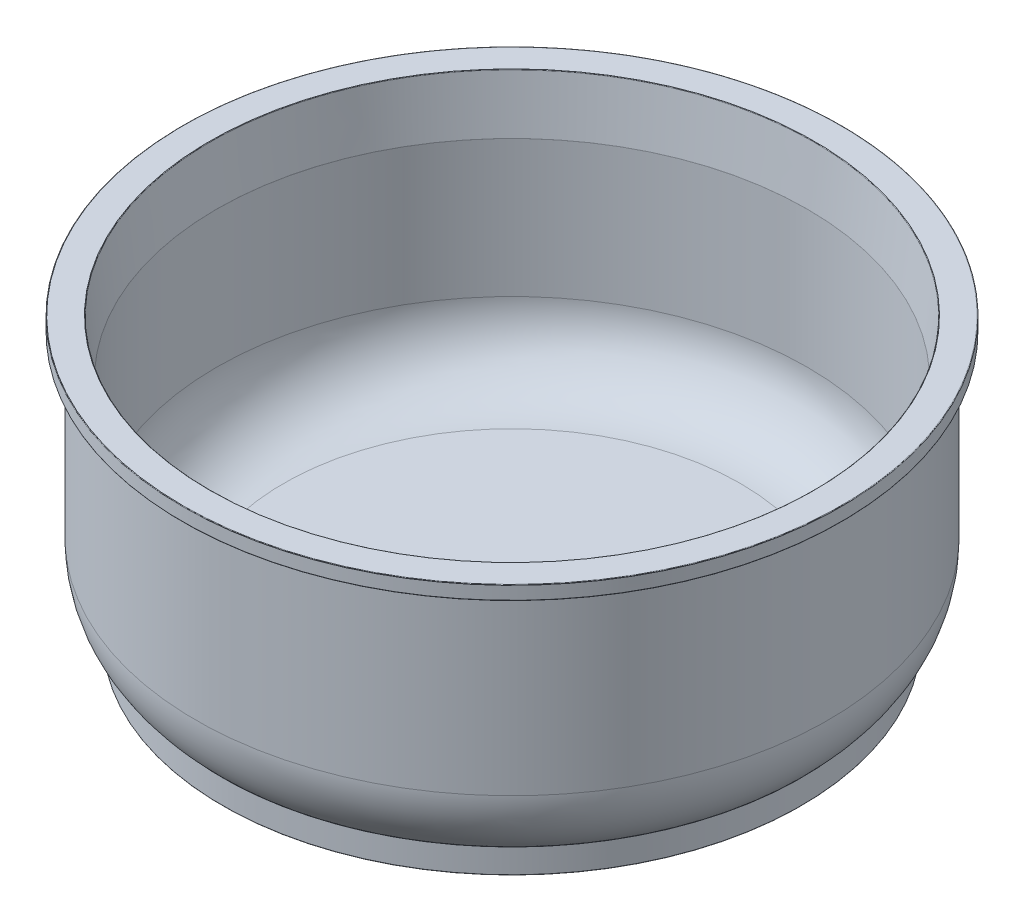
from build123d import *

# Parameters (mm, degrees)
FILLET1_R = 0.3


with BuildPart() as part:
    # Sketch1 → Revolve1 (revolve)
    with BuildSketch(Plane.XY, mode=Mode.PRIVATE) as revolve1_sk:
        with BuildLine():
            ThreePointArc((136.11, 12.39), (164.394271247, 24.105728753), (176.11, 52.39))
            Line((176.11, 52.39), (176.11, 134))
            Line((176.11, 134), (180, 167))
            Line((180, 167), (196.5, 167))
            Line((196.5, 167), (196.5, 158.7))
            Line((196.5, 158.7), (188.5, 158.7))
            Line((188.5, 158.7), (188.5, 52.39))
            ThreePointArc((188.5, 52.39), (173.155324266, 15.344675734), (136.11, 0))
            Line((136.11, 0), (0, 0))
            Line((0, 0), (0, 12.39))
            Line((0, 12.39), (136.11, 12.39))
        make_face()
        with BuildLine():
            ThreePointArc((172.5, 14.700744237), (168.515087472, 11.224208305), (164.2, 8.167109999))
            Line((164.2, 8.167109999), (164.2, 0))
            Line((164.2, 0), (172.5, 0))
            Line((172.5, 0), (172.5, 14.700744237))
        make_face()
    revolve(revolve1_sk.sketch.rotate(Axis((0, 0, 0), (0, 1, 0)), 90), axis=Axis((0, 0, 0), (0, 1, 0)))

    # Fillet1
    fillet1_edges = [part.edges().sort_by_distance(p)[0] for p in [
        (0, 134, 176.11),
        (0, 167, 180),
        (0, 167, 196.5),
        (0, 158.7, 196.5),
        (0, 158.7, 188.5),
        (0, 14.700744237, 172.5),
        (0, 0, 172.5),
        (0, 0, 164.2),
        (0, 8.167109999, 164.2),
    ]]
    fillet(fillet1_edges, radius=FILLET1_R)


solid = part.part
